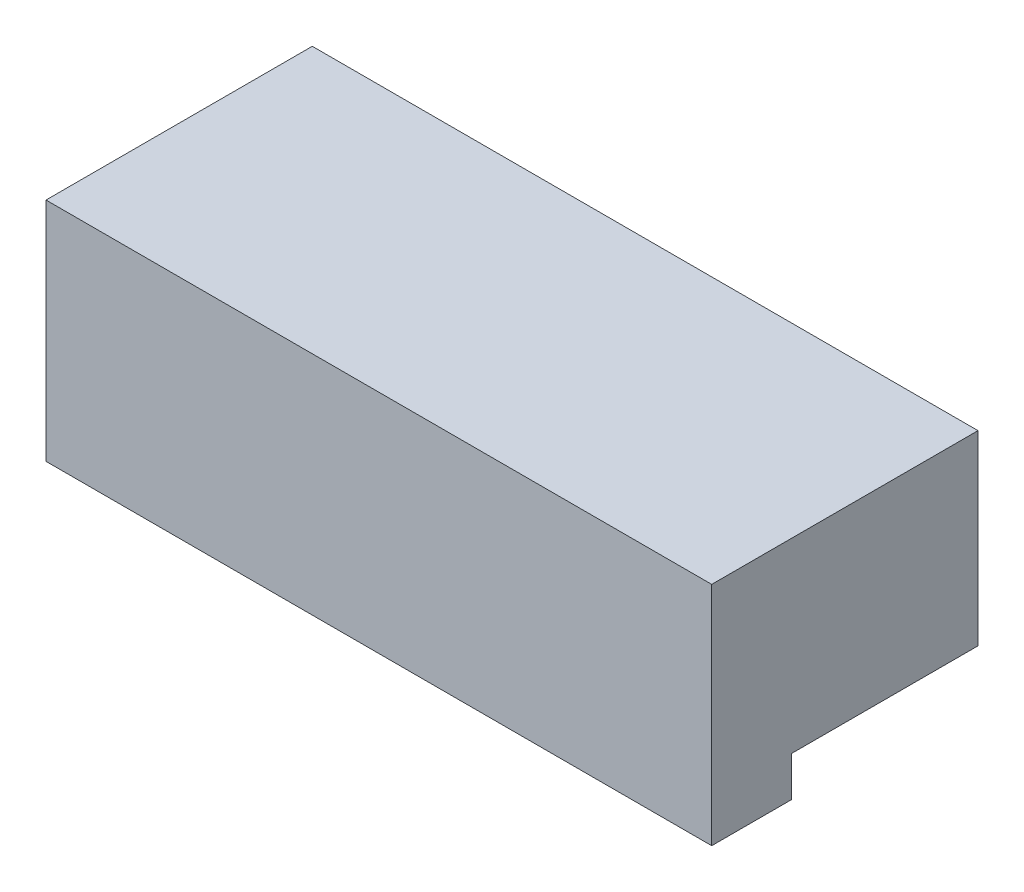
from build123d import *

# Parameters (mm, degrees)
ESQUISSE1_W        = 25
ESQUISSE1_H        = 7
BOSS_EXTRU_1_DEPTH = 10
ESQUISSE2_W        = 25
ESQUISSE2_H        = 3
BOSS_EXTRU_2_DEPTH = 1.5


with BuildPart() as part:
    # Esquisse1 → Boss.-Extru.1 (new body)
    with BuildSketch(Plane.XY):
        with Locations((-3.307033874, -4.093457944)):
            Rectangle(ESQUISSE1_W, ESQUISSE1_H)
    extrude(amount=BOSS_EXTRU_1_DEPTH)

    # Esquisse2 → Boss.-Extru.2 (add)
    with BuildSketch(Plane.XZ.offset(7.593457944)):
        with Locations((-3.307033874, 8.5)):
            Rectangle(ESQUISSE2_W, ESQUISSE2_H)
    extrude(amount=BOSS_EXTRU_2_DEPTH)


solid = part.part
